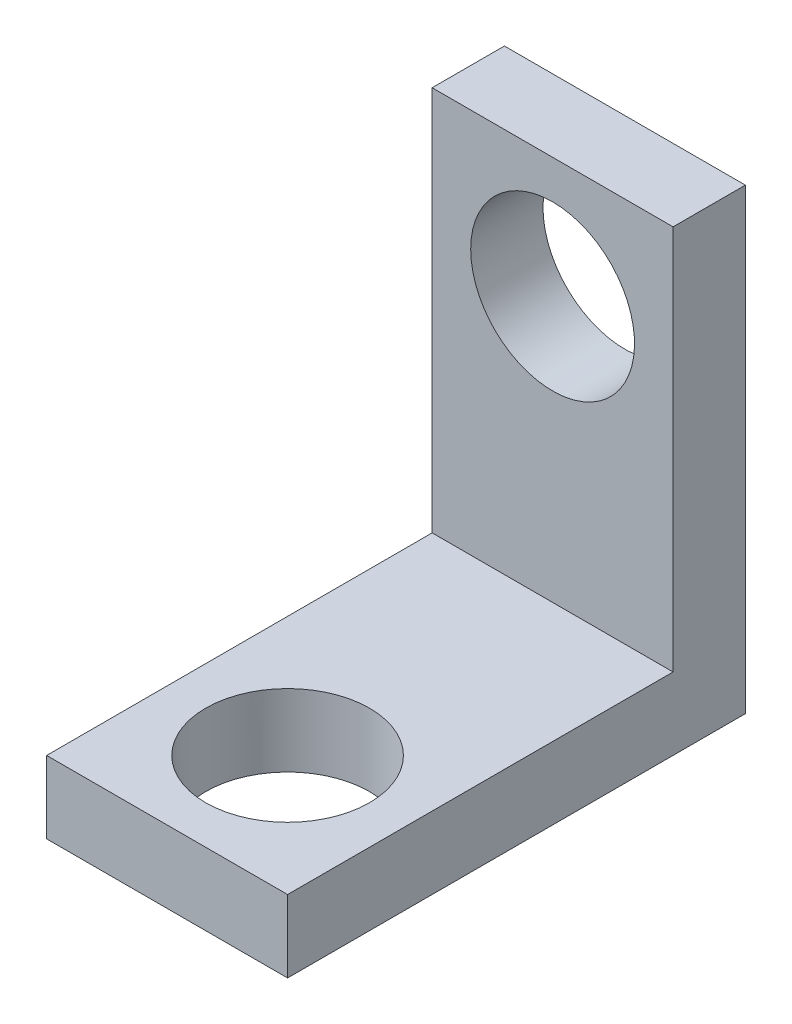
from build123d import *

# Parameters (mm, degrees)
BOSS_EXTRUDE1_DEPTH = 5
SKETCH2_R           = 1.7
CUT_EXTRUDE1_DEPTH  = 12.739356882
SKETCH3_R           = 1.7
CUT_EXTRUDE2_DEPTH  = 12.739356882


with BuildPart() as part:
    # Sketch1 → Boss-Extrude1 (new body)
    with BuildSketch(Plane(origin=(0, 0, 0), x_dir=(0, 0, -1), z_dir=(1, 0, 0))):
        Polygon((-4.75, -3.25), (-4.75, -4.75), (4.75, -4.75), (4.75, 4.75), (3.25, 4.75), (3.25, -3.25), align=None)
    extrude(amount=BOSS_EXTRUDE1_DEPTH)

    # Sketch2 → Cut-Extrude1 (cut, through all)
    with BuildSketch(Plane(origin=(0, 0, -4.75), x_dir=(-1, 0, 0), z_dir=(0, 0, -1))):
        with Locations((-2.5, 2.25)):
            Circle(SKETCH2_R)
    extrude(amount=-CUT_EXTRUDE1_DEPTH, mode=Mode.SUBTRACT)

    # Sketch3 → Cut-Extrude2 (cut, through all)
    with BuildSketch(Plane.XZ.offset(4.75)):
        with Locations(Location((2.5, 2.25, 0), (0, 0, 270))):
            Circle(SKETCH3_R)
    extrude(amount=-CUT_EXTRUDE2_DEPTH, mode=Mode.SUBTRACT)


solid = part.part
